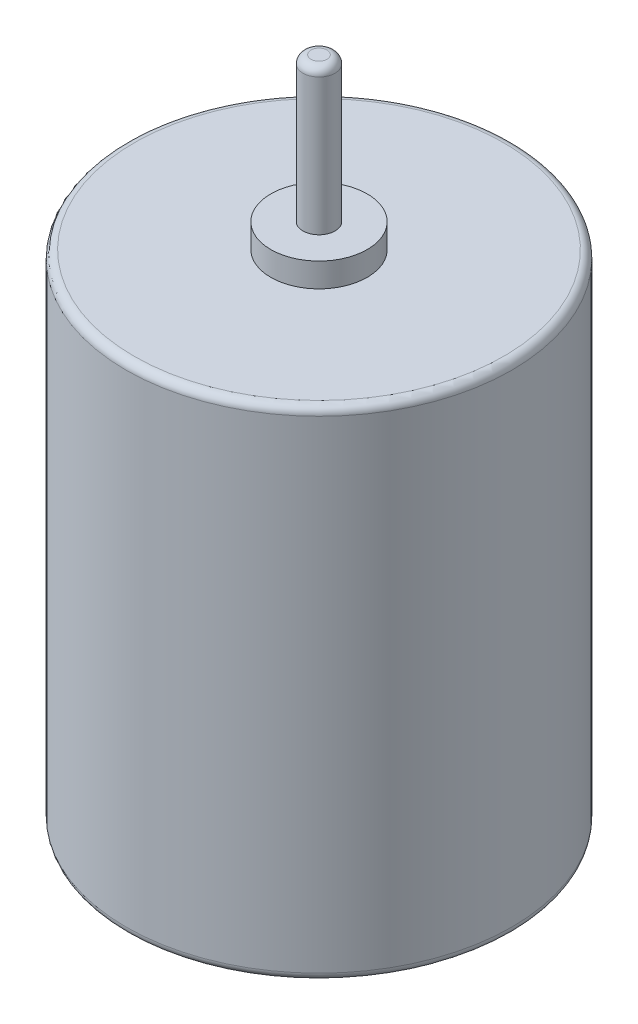
from build123d import *

# Parameters (mm, degrees)
SKETCH1_R                = 12
MOTOR_HOUSING_DEPTH      = 31
SKETCH2_R                = 3
MOTOR_FRONT_NIPPLE_DEPTH = 1.5
SKETCH4_R                = 1
FRONT_AXLE_DEPTH         = 9
FILLET1_R                = 0.5
FILLET2_R                = 0.5
SKETCH5_R                = 4.5
BOSS_EXTRUDE1_DEPTH      = 2
BOSS_EXTRUDE2_START      = 1
SKETCH6_R                = 1
BOSS_EXTRUDE2_DEPTH      = 1
FILLET3_R                = 0.5


with BuildPart() as part:
    # Sketch1 → Motor housing (new body)
    with BuildSketch(Plane(origin=(0, 0, 0), x_dir=(1, 0, 0), z_dir=(0, 1, 0))):
        with Locations(Location((0, 0, 0), (0, 0, 270))):
            Circle(SKETCH1_R)
    extrude(amount=MOTOR_HOUSING_DEPTH)

    # Sketch2 → Motor front nipple (add)
    with BuildSketch(Plane(origin=(0, 31, 0), x_dir=(1, 0, 0), z_dir=(0, 1, 0))):
        with Locations(Location((0, 0, 0), (0, 0, 270))):
            Circle(SKETCH2_R)
    extrude(amount=MOTOR_FRONT_NIPPLE_DEPTH)

    # Sketch4 → Front axle (add)
    with BuildSketch(Plane(origin=(0, 32.5, 0), x_dir=(1, 0, 0), z_dir=(0, 1, 0))):
        with Locations(Location((0, 0, 0), (0, 0, 270))):
            Circle(SKETCH4_R)
    extrude(amount=FRONT_AXLE_DEPTH)

    # Fillet1
    fillet1_edges = [part.edges().sort_by_distance(p)[0] for p in [
        (0, 41.5, -1),
    ]]
    fillet(fillet1_edges, radius=FILLET1_R)

    # Fillet2
    fillet2_edges = [part.edges().sort_by_distance(p)[0] for p in [
        (0, 0, -12),
        (0, 31, -12),
    ]]
    fillet(fillet2_edges, radius=FILLET2_R)

    # Sketch5 → Boss-Extrude1 (add)
    with BuildSketch(Plane.XZ):
        with Locations(Location((0, 0, 0), (0, 0, 90))):
            Circle(SKETCH5_R)
    extrude(amount=BOSS_EXTRUDE1_DEPTH)

    # Sketch6 → Boss-Extrude2 (add)
    with BuildSketch(Plane.XZ.offset(2).offset(BOSS_EXTRUDE2_START)):
        with Locations(Location((0, 0, 0), (0, 0, 90))):
            Circle(SKETCH6_R)
    extrude(amount=-BOSS_EXTRUDE2_DEPTH)

    # Fillet3
    fillet3_edges = [part.edges().sort_by_distance(p)[0] for p in [
        (0, -2, -4.5),
        (0, -3, -1),
    ]]
    fillet(fillet3_edges, radius=FILLET3_R)


solid = part.part
